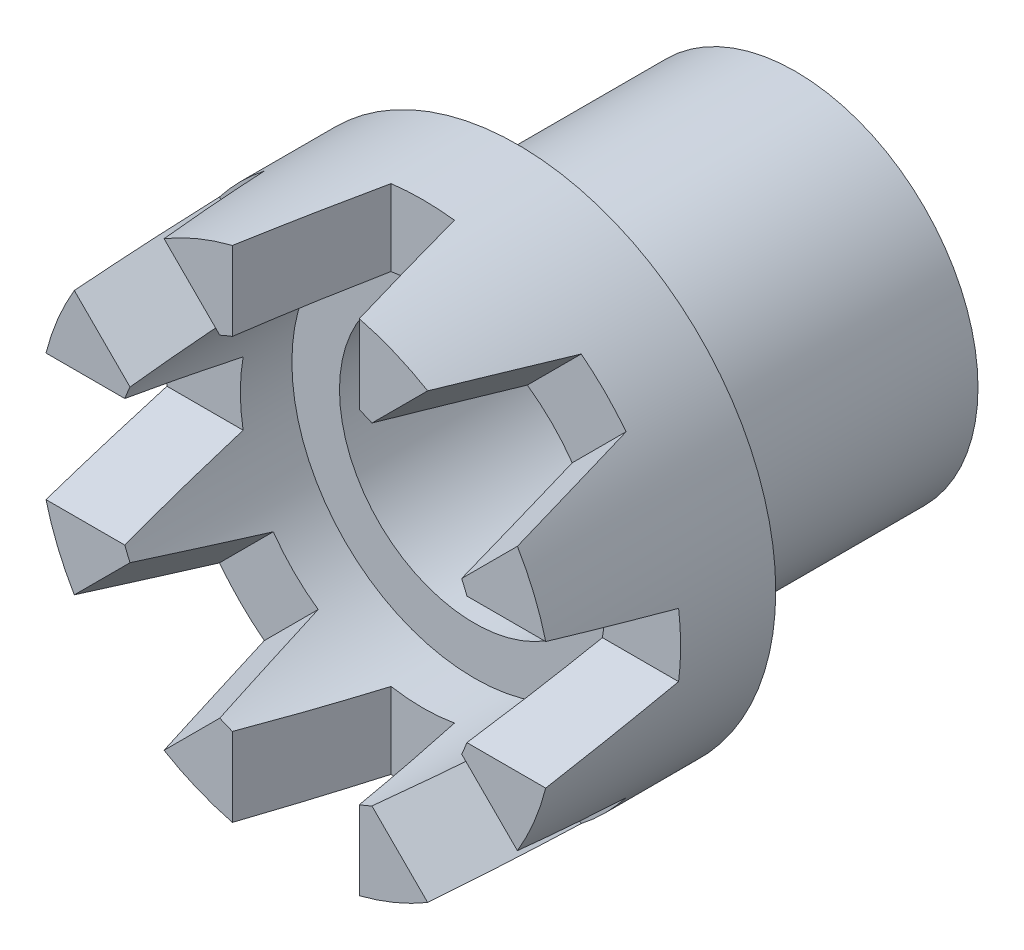
from build123d import *

# Parameters (mm, degrees)
CUT_EXTRUDE_1_DEPTH      = 65
CUT_EXTRUDE_1_DEPTH_BACK = 65
CUT_EXTRUDE_2_DEPTH      = 65
CUT_EXTRUDE_2_DEPTH_BACK = 65
CUT_EXTRUDE_3_DEPTH      = 65
CUT_EXTRUDE_3_DEPTH_BACK = 65
CUT_EXTRUDE_4_DEPTH      = 65
CUT_EXTRUDE_4_DEPTH_BACK = 65


with BuildPart() as part:
    # Эскиз1 → Повернуть1 (revolve)
    with BuildSketch(Plane(origin=(0, 0, 0), x_dir=(0, 0, -1), z_dir=(1, 0, 0))):
        Polygon((0, 46), (0, 65), (56, 65), (56, 46), (126, 46), (126, 32), (123, 32), (123, 34), (45, 34), (45, 46), align=None)
    revolve(axis=Axis((0, 0, 0), (0, 0, -1)))

    # Эскиз2 → Вытянуть1 (cut, two sides: drawn at the far end of the back side and taken through both)
    with BuildSketch(Plane(origin=(0, 0, 0), x_dir=(0, 0, -1), z_dir=(1, 0, 0)).offset(-CUT_EXTRUDE_1_DEPTH_BACK)):
        Polygon((0, 16), (0, -16), (32, -8), (32, 8), align=None)
    extrude(amount=CUT_EXTRUDE_1_DEPTH + CUT_EXTRUDE_1_DEPTH_BACK, mode=Mode.SUBTRACT)

    # Эскиз3 → Вытянуть2 (cut, two sides: drawn at the far end of the back side and taken through both)
    with BuildSketch(Plane(origin=(0, 0, 0), x_dir=(1, 0, 0), z_dir=(0, 1, 0)).offset(-CUT_EXTRUDE_2_DEPTH_BACK)):
        Polygon((-16, 0), (16, 0), (8, 32), (-8, 32), align=None)
    extrude(amount=CUT_EXTRUDE_2_DEPTH + CUT_EXTRUDE_2_DEPTH_BACK, mode=Mode.SUBTRACT)

    # Эскиз4 → Вытянуть3 (cut, two sides: drawn at the far end of the back side and taken through both)
    with BuildSketch(Plane(origin=(0, 0, 0), x_dir=(-0.7071067811865476, -0.7071067811865475, 0), z_dir=(-0.7071067811865475, 0.7071067811865476, 0)).offset(-CUT_EXTRUDE_3_DEPTH_BACK)):
        Polygon((16, 0), (-16, 0), (-8, -32), (8, -32), align=None)
    extrude(amount=CUT_EXTRUDE_3_DEPTH + CUT_EXTRUDE_3_DEPTH_BACK, mode=Mode.SUBTRACT)

    # Эскиз5 → Вытянуть4 (cut, two sides: drawn at the far end of the back side and taken through both)
    with BuildSketch(Plane(origin=(0, 0, 0), x_dir=(0, 0, -1), z_dir=(0.7071067811865476, 0.7071067811865475, 0)).offset(-CUT_EXTRUDE_4_DEPTH_BACK)):
        Polygon((0, 16), (0, -16), (32, -8), (32, 8), align=None)
    extrude(amount=CUT_EXTRUDE_4_DEPTH + CUT_EXTRUDE_4_DEPTH_BACK, mode=Mode.SUBTRACT)


solid = part.part
